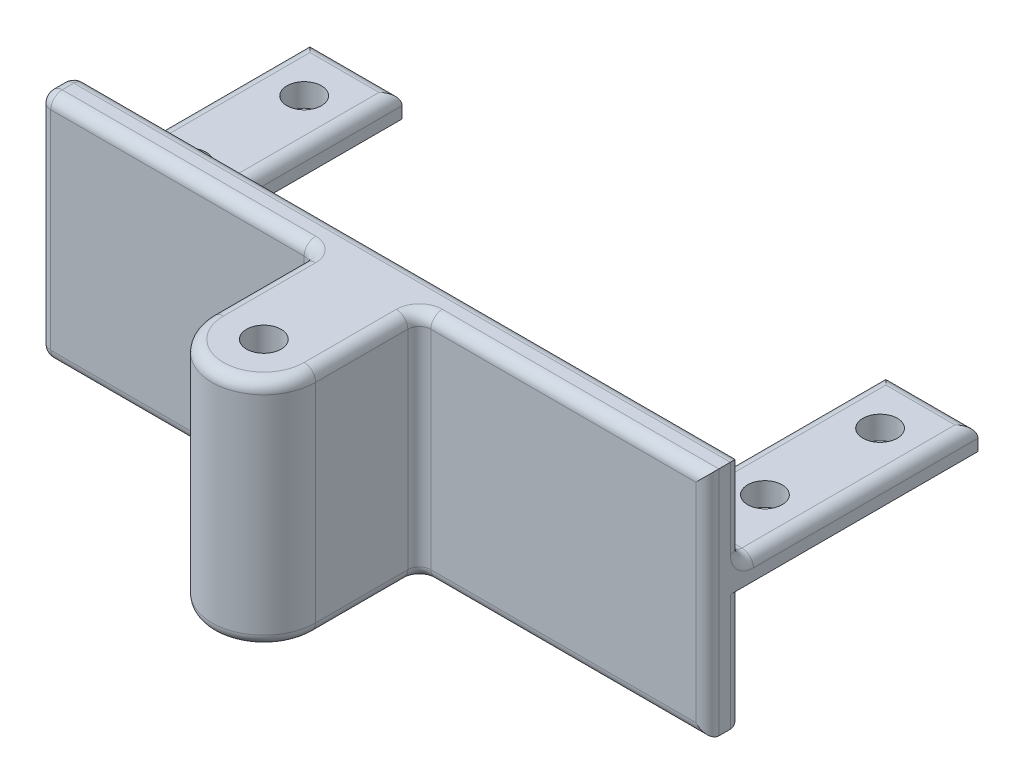
from build123d import *
from build123d.topology import SkipClean

# Parameters (mm, degrees)
SKETCH1_W             = 8
SKETCH1_H             = 19
SKETCH1_R             = 1.5
BOSS_EXTRUDE1_DEPTH   = 2
BOSS_EXTRUDE1_2_DEPTH = 2
SKETCH3_W             = 8
SKETCH3_H             = 2
BOSS_EXTRUDE3_DEPTH   = 4.5
SKETCH4_W             = 9
SKETCH4_H             = 18.077551635
BOSS_EXTRUDE4_DEPTH   = 9
BOSS_EXTRUDE5_DEPTH   = 18.077552
SKETCH6_R             = 1.5
CUT_EXTRUDE1_DEPTH    = 57.189837927
SKETCH1_3_R           = 1.5
CUT_EXTRUDE2_DEPTH    = 55.158745093
SKETCH1_4_R           = 1.5
CUT_EXTRUDE3_DEPTH    = 55.158745093
SKETCH12_W            = 42
SKETCH12_H            = 2
CUT_EXTRUDE5_DEPTH    = 1.5
BOSS_EXTRUDE6_START   = 2
SKETCH14_R            = 1.5
BOSS_EXTRUDE6_DEPTH   = 2
FILLET1_R             = 1


with BuildPart() as part:
    # Sketch1 → Boss-Extrude1 (new body)
    with BuildSketch(Plane(origin=(0, 0, 0), x_dir=(1, 0, 0), z_dir=(0, 1, 0))):
        with Locations((-4.5, 10)):
            Rectangle(SKETCH1_W, SKETCH1_H)
        with Locations(Location((-4.5, 15, 0), (0, 0, 270))):
            Circle(SKETCH1_R, mode=Mode.SUBTRACT)
        with Locations(Location((-4.5, 5, 0), (0, 0, 270))):
            Circle(SKETCH1_R, mode=Mode.SUBTRACT)
    extrude(amount=BOSS_EXTRUDE1_DEPTH)



with BuildPart() as body_2:
    # Sketch1 → Boss-Extrude1 2 (new body)
    with BuildSketch(Plane(origin=(0, 0, 0), x_dir=(1, 0, 0), z_dir=(0, 1, 0))):
        with Locations((45.5, 10)):
            Rectangle(SKETCH1_W, SKETCH1_H)
    extrude(amount=BOSS_EXTRUDE1_2_DEPTH)


with BuildPart() as part_1:
    add(part.part)

    add(body_2.part)  # Boss-Extrude3 merges body 2
    # Sketch3 → Boss-Extrude3 (add)
    with BuildSketch(Plane.XY.offset(-0.5)):
        Polygon((-0.5, 2), (-0.5, 0), (49.5, 0), (49.5, 7.944947695), (-8.5, 7.944947695), (-8.5, 2), align=None)
        Polygon((-0.5, 0), (-8.5, 0), (-8.5, -10.13260394), (49.5, -10.13260394), (49.5, 0), align=None)
        with Locations((-4.5, 1)):
            Rectangle(SKETCH3_W, SKETCH3_H)
    extrude(amount=BOSS_EXTRUDE3_DEPTH)

    # Sketch4 → Boss-Extrude4 (add)
    with BuildSketch(Plane.XY.offset(4)):
        with Locations((20, -1.093828123)):
            Rectangle(SKETCH4_W, SKETCH4_H)
    extrude(amount=BOSS_EXTRUDE4_DEPTH)

    # Sketch5 → Boss-Extrude5 (add, through all)
    with BuildSketch(Plane(origin=(0, 7.944947695, 0), x_dir=(1, 0, 0), z_dir=(0, 1, 0))):
        with BuildLine():
            Line((18.5, -13), (15.5, -13))
            ThreePointArc((15.5, -13), (20, -17.5), (24.5, -13))
            Line((24.5, -13), (21.5, -13))
            ThreePointArc((21.5, -13), (20, -14.5), (18.5, -13))
        make_face()
    extrude(amount=-BOSS_EXTRUDE5_DEPTH)

    # Sketch6 → Cut-Extrude1 (cut, through all)
    with SkipClean():  # the faces are left unmerged after this step: merging them gives an invalid solid
        with BuildSketch(Plane(origin=(0, 7.944947695, 0), x_dir=(1, 0, 0), z_dir=(0, 1, 0))):
            with Locations(Location((20, -13, 0), (0, 0, 270))):
                Circle(SKETCH6_R)
        extrude(amount=-CUT_EXTRUDE1_DEPTH, mode=Mode.SUBTRACT)

    # Sketch1<3> → Cut-Extrude2 (cut, through all)
    with SkipClean():  # the faces are left unmerged after this step: merging them gives an invalid solid
        with BuildSketch(Plane(origin=(0, 0, 0), x_dir=(1, 0, 0), z_dir=(0, 1, 0))):
            with Locations(Location((45.5, 15, 0), (0, 0, 90))):
                Circle(SKETCH1_3_R)
        extrude(amount=CUT_EXTRUDE2_DEPTH, mode=Mode.SUBTRACT)

    # Sketch1<4> → Cut-Extrude3 (cut, through all)
    with SkipClean():  # the faces are left unmerged after this step: merging them gives an invalid solid
        with BuildSketch(Plane(origin=(0, 0, 0), x_dir=(1, 0, 0), z_dir=(0, 1, 0))):
            with Locations(Location((45.5, 5, 0), (0, 0, 90))):
                Circle(SKETCH1_4_R)
        extrude(amount=CUT_EXTRUDE3_DEPTH, mode=Mode.SUBTRACT)

    # Sketch12 → Cut-Extrude5 (cut)
    with SkipClean():  # the faces are left unmerged after this step: merging them gives an invalid solid
        with BuildSketch(Plane(origin=(0, 0, -0.5), x_dir=(-1, 0, 0), z_dir=(0, 0, -1))):
            Polygon((-41.5, 2), (0.5, 2), (8.5, 2), (8.5, 7.944947695), (-49.5, 7.944947695), (-49.5, 2), align=None)
            with Locations((-20.5, 1)):
                Rectangle(SKETCH12_W, SKETCH12_H)
            Polygon((-41.5, 0), (-49.5, 0), (-49.5, -10.13260394), (8.5, -10.13260394), (8.5, 0), (0.5, 0), align=None)
        extrude(amount=-CUT_EXTRUDE5_DEPTH, mode=Mode.SUBTRACT)

    # Sketch14 → Boss-Extrude6 (add)
    with BuildSketch(Plane(origin=(0, 7.944947695, 0), x_dir=(1, 0, 0), z_dir=(0, 1, 0)).offset(BOSS_EXTRUDE6_START)):
        with BuildLine():
            Line((49.5, -1), (-8.5, -1))
            Line((-8.5, -1), (-8.5, -4))
            Line((-8.5, -4), (15.5, -4))
            Line((15.5, -4), (15.5, -13))
            ThreePointArc((15.5, -13), (20, -17.5), (24.5, -13))
            Line((24.5, -13), (24.5, -4))
            Line((24.5, -4), (49.5, -4))
            Line((49.5, -4), (49.5, -1))
        make_face()
        with Locations(Location((20, -13, 0), (0, 0, 270))):
            Circle(SKETCH14_R, mode=Mode.SUBTRACT)
    extrude(amount=-BOSS_EXTRUDE6_DEPTH)

    # Fillet1
    fillet1_edges = [part_1.edges().sort_by_distance(p)[0] for p in [
        (-0.5, 2, -9.25),
        (45.5, 2, 1),
        (49.5, 5.972473847, 1),
        (-8.5, 5.972473847, 1),
        (-4.5, 2, 1),
        (-0.5, 1, 1),
        (-8.5, -5.06630197, 1),
        (20.5, -10.13260394, 1),
        (49.5, -5.06630197, 1),
        (41.5, 1, 1),
        (20, 9.944947695, 17.5),
        (24.5, 9.944947695, 8.5),
        (37, 9.944947695, 4),
        (20.5, 9.944947695, 1),
        (-8.5, 9.944947695, 2.5),
        (-4.5, 2, -19.5),
        (3.5, 9.944947695, 4),
        (15.5, 9.944947695, 8.5),
        (-8.5, 2, -9.25),
        (-8.5, -0.093828123, 4),
        (-8.5, -10.13260394, 2.5),
        (3.5, -10.13260394, 4),
        (49.5, -0.093828123, 4),
        (49.5, 2, -9.25),
        (45.5, 2, -19.5),
        (41.5, 2, -9.25),
        (37, -10.13260394, 4),
        (15.5, -10.13260394, 8.5),
        (24.5, -0.093828123, 4),
        (24.5, -10.13260394, 8.5),
        (15.5, -0.093828123, 4),
        (20, -10.132604305, 17.5),
    ]]
    fillet(fillet1_edges, radius=FILLET1_R)


solid = part_1.part
